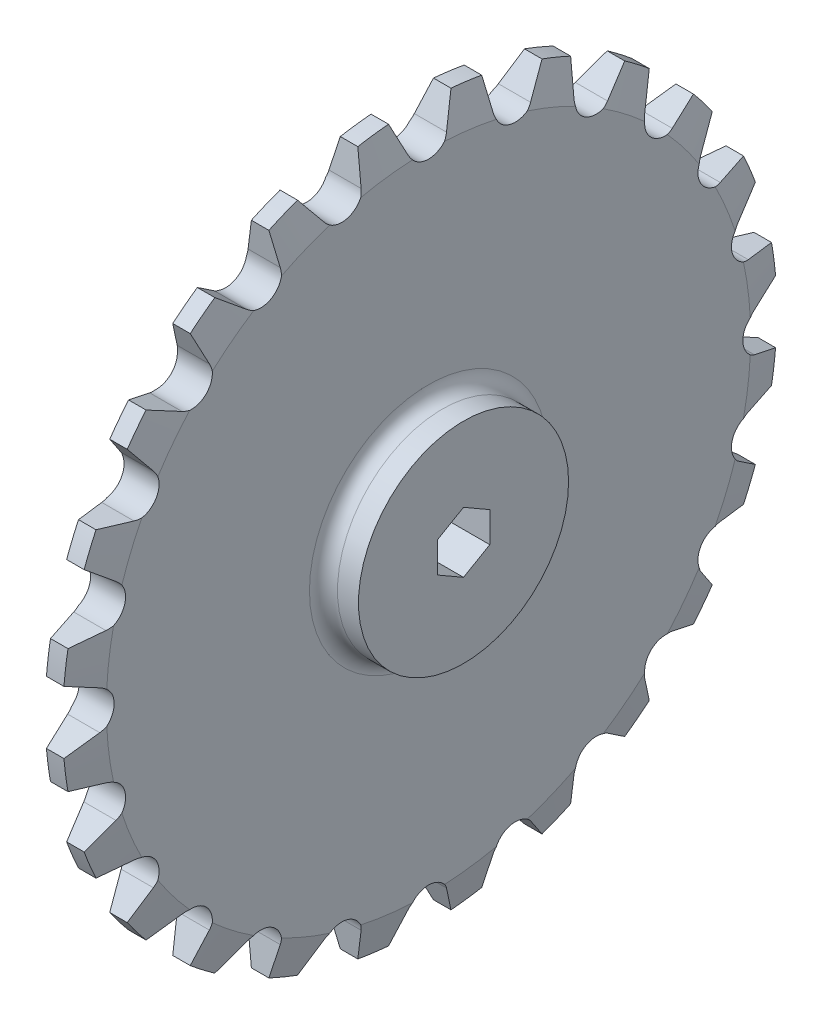
from build123d import *

# Parameters (mm, degrees)
SKETCH1_W               = 6.35
SKETCH1_H               = 58.42
SKETCH1_W_2             = 12.7
SKETCH1_H_2             = 19.05
CUT_EXTRUDE1_DEPTH      = 94.558582183
CIRPATTERN1_COUNT       = 24
CUT_EXTRUDE2_DEPTH      = 95.717339497
CUT_EXTRUDE2_DEPTH_BACK = 95.717339497
FILLET1_R               = 2.54


with BuildPart() as part:
    # Sketch1 → Revolve1 (revolve)
    with BuildSketch(Plane.XY, mode=Mode.PRIVATE) as revolve1_sk:
        with Locations((-3.175, 29.21)):
            Rectangle(SKETCH1_W, SKETCH1_H)
        with Locations((-12.7, 9.525)):
            Rectangle(SKETCH1_W_2, SKETCH1_H_2)
        with Locations((3.175, 9.525)):
            Rectangle(SKETCH1_W, SKETCH1_H_2)
        Polygon((-1.5875, 64.77), (0, 58.42), (-6.35, 58.42), (-4.7625, 64.77), align=None)
    revolve(revolve1_sk.sketch.rotate(Axis((0, 0, 0), (-1, 0, 0)), 90), axis=Axis((0, 0, 0), (-1, 0, 0)))

    # Sketch2 → Cut-Extrude1 (cut, symmetric)
    with BuildSketch(Plane(origin=(0, 0, 0), x_dir=(0, 0, -1), z_dir=(1, 0, 0))):
        with BuildLine():
            Line((3.777404922, 60.314244713), (3.910657339, 60.2967017))
            Line((3.910657339, 60.2967017), (10.01643315, 75.037348471))
            Line((10.01643315, 75.037348471), (-10.01643315, 75.037348471))
            Line((-10.01643315, 75.037348471), (-3.910657339, 60.2967017))
            Line((-3.910657339, 60.2967017), (-3.777404922, 60.314244713))
            ThreePointArc((-3.777404922, 60.314244713), (-0.249185922, 64.613392003), (3.81, 60.811549506))
            ThreePointArc((3.81, 60.811549506), (3.801842498, 60.562363583), (3.777404922, 60.314244713))
        make_face()
        with BuildLine():
            ThreePointArc((3.519981019, 59.353525629), (3.680177398, 59.825448944), (3.777404922, 60.314244713))
            Line((3.777404922, 60.314244713), (0, 60.811549506))
            Line((0, 60.811549506), (-3.777404922, 60.314244713))
            ThreePointArc((-3.777404922, 60.314244713), (-3.680177398, 59.825448944), (-3.519981019, 59.353525629))
            ThreePointArc((-3.519981019, 59.353525629), (0, 57.001549506), (3.519981019, 59.353525629))
        make_face()
        with BuildLine():
            Line((0, 60.811549506), (3.777404922, 60.314244713))
            ThreePointArc((3.777404922, 60.314244713), (3.801842498, 60.562363583), (3.81, 60.811549506))
            ThreePointArc((3.81, 60.811549506), (-0.249185922, 64.613392003), (-3.777404922, 60.314244713))
            Line((-3.777404922, 60.314244713), (0, 60.811549506))
        make_face()
        with BuildLine():
            Line((3.519981019, 59.353525629), (3.910657339, 60.2967017))
            Line((3.910657339, 60.2967017), (3.777404922, 60.314244713))
            ThreePointArc((3.777404922, 60.314244713), (3.680177398, 59.825448944), (3.519981019, 59.353525629))
        make_face()
        with BuildLine():
            Line((-3.910657339, 60.2967017), (-3.519981019, 59.353525629))
            ThreePointArc((-3.519981019, 59.353525629), (-3.680177398, 59.825448944), (-3.777404922, 60.314244713))
            Line((-3.777404922, 60.314244713), (-3.910657339, 60.2967017))
        make_face()
    cut_extrude1 = extrude(amount=CUT_EXTRUDE1_DEPTH, both=True, mode=Mode.SUBTRACT)

    # CirPattern1: Cut-Extrude1 ×24 about axis
    cirpattern1_axis = Axis((0, 0, 0), (1, 0, 0))
    for i in range(1, CIRPATTERN1_COUNT):
        add(cut_extrude1.rotate(cirpattern1_axis, i * 360 / CIRPATTERN1_COUNT), mode=Mode.SUBTRACT)

    # Sketch3 → Cut-Extrude2 (cut, two sides: drawn at the far end of the back side and taken through both)
    with BuildSketch(Plane.ZY.offset(19.05).offset(-CUT_EXTRUDE2_DEPTH_BACK)):
        Polygon((0, 5.499261314), (-4.7625, 2.749630657), (-4.7625, -2.749630657), (0, -5.499261314), (4.7625, -2.749630657), (4.7625, 2.749630657), align=None)
    extrude(amount=CUT_EXTRUDE2_DEPTH + CUT_EXTRUDE2_DEPTH_BACK, mode=Mode.SUBTRACT)

    # Fillet1
    fillet1_edges = [part.edges().sort_by_distance(p)[0] for p in [
        (0, 0, 19.05),
        (-6.35, 0, 19.05),
    ]]
    fillet(fillet1_edges, radius=FILLET1_R)


solid = part.part
